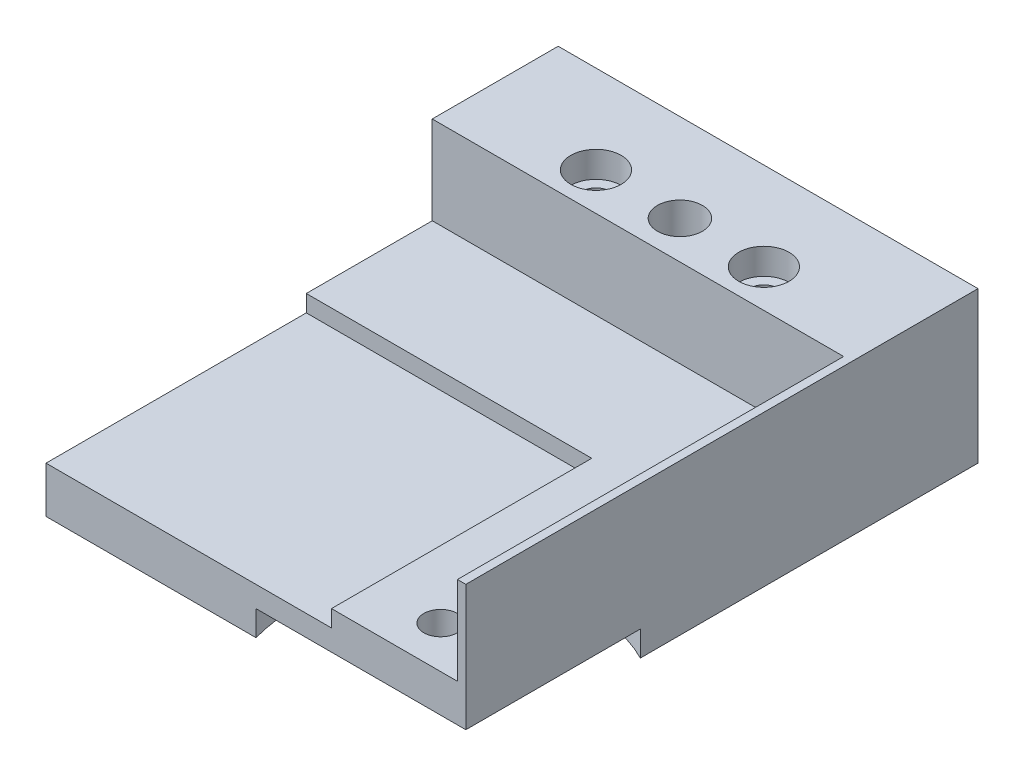
from build123d import *

# Parameters (mm, degrees)
OUTLINESKETCH2_W                               = 50
OUTLINESKETCH2_H                               = 61
OUTLINESKETCH2_R                               = 2
OUTLINEBOSS_EXTRUDE1_DEPTH                     = 18
BUILDPLATECUTOUTSKETCH1_W                      = 49
BUILDPLATECUTOUTSKETCH1_H                      = 46
BUILDPLATECUTOUTCUT_EXTRUDE7_DEPTH             = 10.5
HEATMATCUTSKETCH3_W                            = 34
HEATMATCUTSKETCH3_H                            = 31
HEATMATCUT_EXTRUDE8_DEPTH                      = 2
BALLJOINTCUT_EXTRUDE9_DEPTH                    = 3
SKETCH1_R                                      = 1.75
SKETCH1_R_2                                    = 2.675
ZENDSTOPSWITCHMOUNTHOLESCUT_EXTRUDE1_DEPTH     = 81.901174281
SKETCH3_R                                      = 3
ZENDSTOPSWITCHMOUNTBOREHOLESCUT_EXTRUDE2_DEPTH = 3.1
SKETCH4_R                                      = 4.125
ZENDSTOPSWITCHCONNINGTOWERTBORECUT_EXTRU_DEPTH = 7.5


with BuildPart() as part:
    # OutlineSketch2 → OutlineBoss-Extrude1 (new body)
    with BuildSketch(Plane(origin=(0, 0, 0), x_dir=(1, 0, 0), z_dir=(0, 1, 0))):
        with Locations((25, 30.5)):
            Rectangle(OUTLINESKETCH2_W, OUTLINESKETCH2_H)
        with Locations(Location((42, 5, 0), (0, 0, 270))):
            Circle(OUTLINESKETCH2_R, mode=Mode.SUBTRACT)
    extrude(amount=OUTLINEBOSS_EXTRUDE1_DEPTH)

    # BuildPlateCutoutSketch1 → BuildPlateCutoutCut-Extrude7 (cut)
    with BuildSketch(Plane(origin=(0, 18, 0), x_dir=(1, 0, 0), z_dir=(0, 1, 0))):
        with Locations((24.5, 23)):
            Rectangle(BUILDPLATECUTOUTSKETCH1_W, BUILDPLATECUTOUTSKETCH1_H)
    extrude(amount=-BUILDPLATECUTOUTCUT_EXTRUDE7_DEPTH, mode=Mode.SUBTRACT)

    # HeatMatCutSketch3 → HeatMatCut-Extrude8 (cut)
    with BuildSketch(Plane(origin=(0, 7.5, 0), x_dir=(1, 0, 0), z_dir=(0, 1, 0))):
        with Locations((17, 15.5)):
            Rectangle(HEATMATCUTSKETCH3_W, HEATMATCUTSKETCH3_H)
    extrude(amount=-HEATMATCUT_EXTRUDE8_DEPTH, mode=Mode.SUBTRACT)

    # BallJointCutoutSketch4 → BallJointCut-Extrude9 (cut)
    with BuildSketch(Plane.XZ):
        with BuildLine():
            Line((25.020895194, 0), (50, 0))
            Line((50, 0), (50, -20.788920166))
            ThreePointArc((50, -20.788920166), (30.677417203, -18.604746187), (25.020895194, 0))
        make_face()
    extrude(amount=-BALLJOINTCUT_EXTRUDE9_DEPTH, mode=Mode.SUBTRACT)

    # Sketch1 → ZEndStopSwitchMountHolesCut-Extrude1 (cut, through all)
    with BuildSketch(Plane(origin=(0, 18, 0), x_dir=(1, 0, 0), z_dir=(0, 1, 0))):
        with Locations(Location((35, 50.5, 0), (0, 0, 270))):
            Circle(SKETCH1_R)
        with Locations(Location((25, 50.5, 0), (0, 0, 270))):
            Circle(SKETCH1_R_2)
        with Locations(Location((15, 50.5, 0), (0, 0, 270))):
            Circle(SKETCH1_R)
    extrude(amount=-ZENDSTOPSWITCHMOUNTHOLESCUT_EXTRUDE1_DEPTH, mode=Mode.SUBTRACT)

    # Sketch3 → ZEndStopSwitchMountBoreHolesCut-Extrude2 (cut)
    with BuildSketch(Plane(origin=(0, 18, 0), x_dir=(1, 0, 0), z_dir=(0, 1, 0))):
        with Locations(Location((35, 50.5, 0), (0, 0, 270))):
            Circle(SKETCH3_R)
        with Locations(Location((15, 50.5, 0), (0, 0, 270))):
            Circle(SKETCH3_R)
    extrude(amount=-ZENDSTOPSWITCHMOUNTBOREHOLESCUT_EXTRUDE2_DEPTH, mode=Mode.SUBTRACT)

    # Sketch4 → ZEndStopSwitchConningTowertBoreCut-Extrude1 (cut)
    with BuildSketch(Plane.XZ):
        with Locations(Location((25, -50.5, 0), (0, 0, 270))):
            Circle(SKETCH4_R)
    extrude(amount=-ZENDSTOPSWITCHCONNINGTOWERTBORECUT_EXTRU_DEPTH, mode=Mode.SUBTRACT)


solid = part.part
